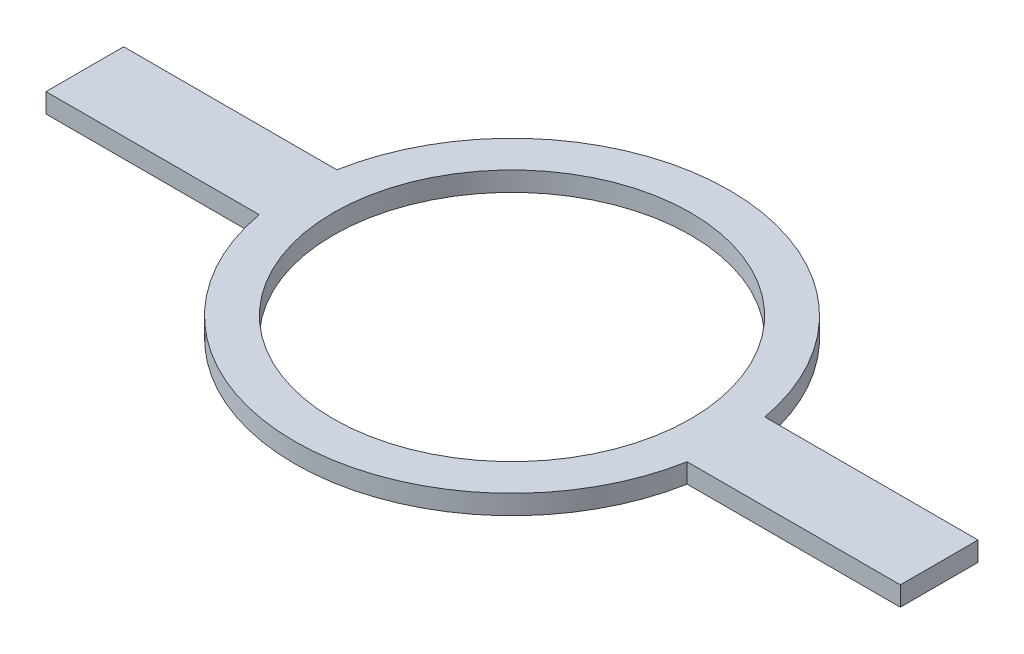
from build123d import *

# Parameters (mm, degrees)
SKETCH1_R           = 58.42
BOSS_EXTRUDE1_DEPTH = 6.35


with BuildPart() as part:
    # Sketch1 → Boss-Extrude1 (new body)
    with BuildSketch(Plane(origin=(0, 0, 0), x_dir=(1, 0, 0), z_dir=(0, 1, 0))):
        with BuildLine():
            Line((69.976884755, 12.7), (139.7, 12.7))
            Line((139.7, 12.7), (139.7, -12.7))
            Line((139.7, -12.7), (69.976884755, -12.7))
            ThreePointArc((69.976884755, -12.7), (0, -71.12), (-69.976884755, -12.7))
            Line((-69.976884755, -12.7), (-139.7, -12.7))
            Line((-139.7, -12.7), (-139.7, 12.7))
            Line((-139.7, 12.7), (-69.976884755, 12.7))
            ThreePointArc((-69.976884755, 12.7), (0, 71.12), (69.976884755, 12.7))
        make_face()
        with Locations(Location((0, 0, 0), (0, 0, 270))):
            Circle(SKETCH1_R, mode=Mode.SUBTRACT)
    extrude(amount=BOSS_EXTRUDE1_DEPTH)


solid = part.part
